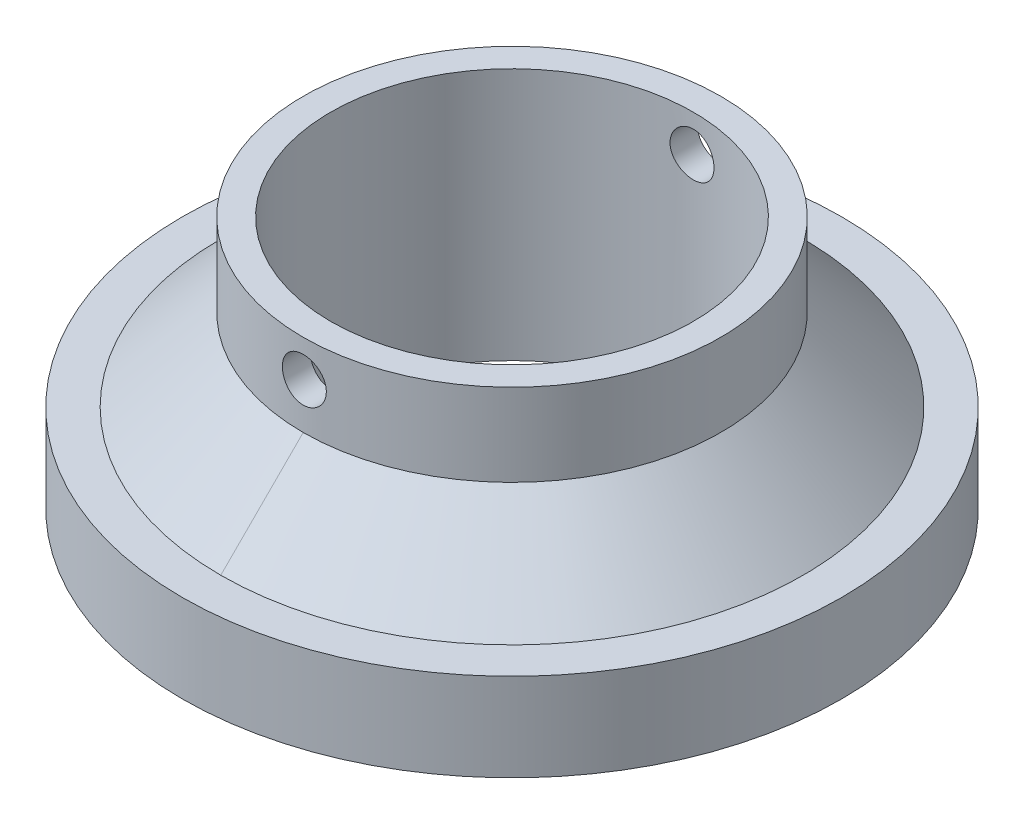
from build123d import *

# Parameters (mm, degrees)
SKETCH_1_R               = 30
EXTRUDE_1_DEPTH          = 8
SKETCH_2_R               = 16.5
CUT_EXTRUDE_1_DEPTH      = 8
EXTRUDE_START            = 15
SKETCH_3_R               = 19
SKETCH_3_R_2             = 16.5
EXTRUDE_2_DEPTH          = 15
CUT_EXTRUDE_2_DEPTH      = 26
CUT_EXTRUDE_2_DEPTH_BACK = 22
SKETCH_6_R               = 2


with BuildPart() as part:
    # 草图1 → 凸台-拉伸1 (new body)
    with BuildSketch(Plane(origin=(0, 0, 0), x_dir=(1, 0, 0), z_dir=(0, 1, 0))):
        with Locations(Location((0, 0, 0), (0, 0, 270))):
            Circle(SKETCH_1_R)
    extrude(amount=EXTRUDE_1_DEPTH)

    # 草图2 → 切除-拉伸1 (cut)
    with BuildSketch(Plane(origin=(0, 8, 0), x_dir=(1, 0, 0), z_dir=(0, 1, 0))):
        with Locations(Location((0, 0, 0), (0, 0, 270))):
            Circle(SKETCH_2_R)
    extrude(amount=-CUT_EXTRUDE_1_DEPTH, mode=Mode.SUBTRACT)

    # 草图3 → 凸台-拉伸2 (add)
    with BuildSketch(Plane(origin=(0, 8, 0), x_dir=(1, 0, 0), z_dir=(0, 1, 0)).offset(EXTRUDE_START)):
        with Locations(Location((0, 0, 0), (0, 0, 270))):
            Circle(SKETCH_3_R)
        with Locations(Location((0, 0, 0), (0, 0, 270))):
            Circle(SKETCH_3_R_2, mode=Mode.SUBTRACT)
    extrude(amount=-EXTRUDE_2_DEPTH)

    # 扫描1: sweep along a curve in space
    with BuildLine() as sweep_1_path:
        ThreePointArc((0, 8, 19), (13.435028843, 8, 13.435028843), (19, 8, 0))
        ThreePointArc((19, 8, 0), (13.435028843, 8, -13.435028843), (0, 8, -19))
        ThreePointArc((0, 8, -19), (-13.435028843, 8, -13.435028843), (-19, 8, 0))
        ThreePointArc((-19, 8, 0), (-13.435028843, 8, 13.435028843), (0, 8, 19))
    # 草图5 → 扫描1 (sweep)
    with BuildSketch(Plane.XY):
        Polygon((-19, 15.5), (-19, 8), (-26.5, 8), align=None)
    sweep(path=sweep_1_path.line)

    # 草图6 → 切除-拉伸2 (cut, two sides: drawn at the far end of the back side and taken through both)
    with BuildSketch(Plane.XY.offset(-CUT_EXTRUDE_2_DEPTH_BACK)):
        with Locations(Location((0, 19.65958907, 0), (0, 0, 180))):
            Circle(SKETCH_6_R)
    extrude(amount=CUT_EXTRUDE_2_DEPTH + CUT_EXTRUDE_2_DEPTH_BACK, mode=Mode.SUBTRACT)


solid = part.part
